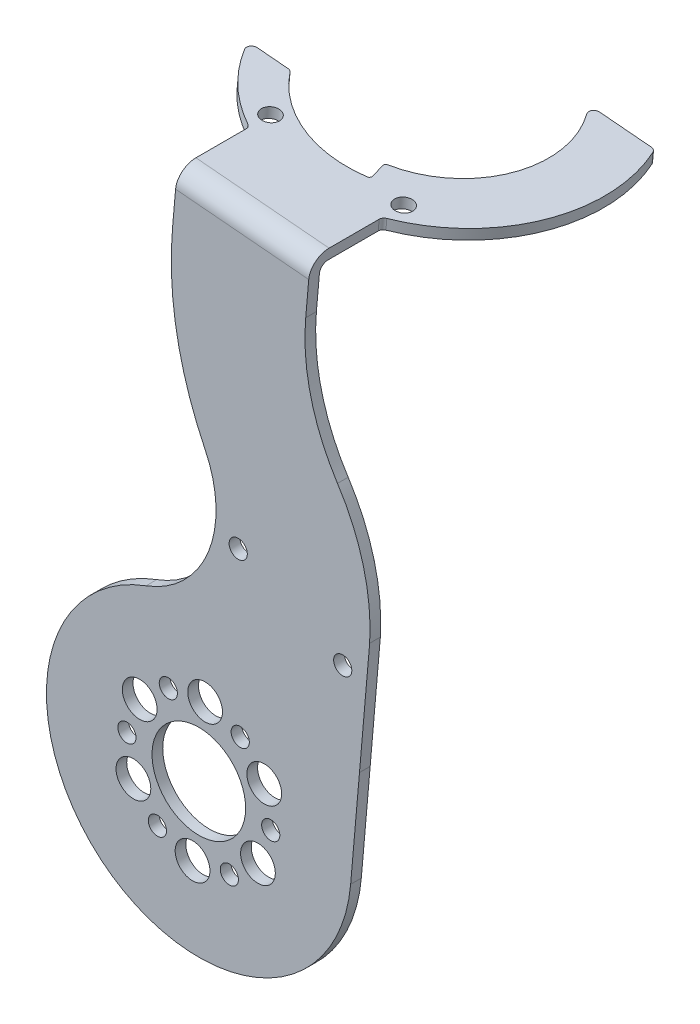
from build123d import *

# Parameters (mm, degrees)
EXTRUDE_1_DEPTH               = 2
EXTRUDE_2_DEPTH               = 2
HOLE_WIZARD_6_5_6_5_1_D       = 6.5
HOLE_WIZARD_6_5_6_5_1_DEPTH   = 51.1
HOLE_WIZARD_3_4_3_4_1_D       = 3.4
HOLE_WIZARD_3_4_3_4_1_DEPTH   = 51.1
HOLE_WIZARD_17_5_17_5_1_D     = 17.5
HOLE_WIZARD_17_5_17_5_1_DEPTH = 51.1
HOLE_WIZARD_3_4_3_4_2_D       = 3.4
HOLE_WIZARD_3_4_3_4_2_DEPTH   = 6.616402139
FILLET_1_R                    = 0.5
FILLET_2_R                    = 1
FILLET_3_R                    = 1.5
FILLET_4_R                    = 3.5


with BuildPart() as part:
    # 草图1 → 凸台-拉伸1 (new body)
    with BuildSketch(Plane.XY.offset(2)):
        with BuildLine():
            Line((19.991405474, 85.081394601), (20.688651416, 93.050952185))
            Line((20.688651416, 93.050952185), (-4.216216036, 95.229845754))
            Line((-4.216216036, 95.229845754), (-4.913461978, 87.260288169))
            ThreePointArc((-4.913461978, 87.260288169), (-4.101645556, 70.349808931), (1.198916656, 54.271021844))
            ThreePointArc((1.198916656, 54.271021844), (1.780962088, 38.051078797), (-9.859178165, 26.740355381))
            ThreePointArc((-9.859178165, 26.740355381), (-17.30251519, -22.646698835), (28.391548896, -2.483938668))
            Line((28.391548896, -2.483938668), (30.047508008, 16.443760595))
            Line((30.047508008, 16.443760595), (31.950173771, 38.33545379))
            ThreePointArc((31.950173771, 38.33545379), (30.780358309, 50.262124766), (25.93459204, 61.222621928))
            ThreePointArc((25.93459204, 61.222621928), (20.968028554, 72.655064005), (19.991405474, 85.081394601))
        make_face()
    extrude(amount=-EXTRUDE_1_DEPTH)

    # 草图2 → 凸台-拉伸2 (add)
    with BuildSketch(Plane(origin=(8.23621769, 94.14039897, 0), x_dir=(-0.9961946980917458, 0.08715574274765517, 0), z_dir=(0.08715574274765517, 0.9961946980917458, 0))):
        with BuildLine():
            Line((-15.491933385, -49.1), (-25.850531909, -49.1))
            ThreePointArc((-25.850531909, -49.1), (-26.858253967, -27.566679809), (-12.5, -11.48750305))
            Line((-12.5, -11.48750305), (-12.5, 2))
            Line((-12.5, 2), (12.5, 2))
            Line((12.5, 2), (12.5, -11.48750305))
            ThreePointArc((12.5, -11.48750305), (19.329574132, -16.156801489), (24.530313512, -22.590909091))
            ThreePointArc((24.530313512, -22.590909091), (24.538246516, -23.595433694), (23.669600757, -24.1))
            Line((23.669600757, -24.1), (17.437387992, -24.1))
            ThreePointArc((17.437387992, -24.1), (7.133948284, -16.553241572), (-5.629314231, -16.091113278))
            Line((-5.629314231, -16.091113278), (-4.658742812, -19.713335127))
            ThreePointArc((-4.658742812, -19.713335127), (-16.934605215, -30.999250357), (-14.67656847, -47.521052632))
            ThreePointArc((-14.67656847, -47.521052632), (-14.603410068, -48.558831468), (-15.491933385, -49.1))
        make_face()
    extrude(amount=EXTRUDE_2_DEPTH)

    # Ø6.5 (6.5) 直径孔1
    with Locations(Plane.XY.offset(2)):
        with Locations((11.058552598, -7.743281891), (1.176602527, 13.448628424), (-12.235155125, -5.705346533), (-11.058552598, 7.743281891), (12.235155125, 5.705346533), (-1.176602527, -13.448628424)):
            Hole(HOLE_WIZARD_6_5_6_5_1_D / 2, depth=HOLE_WIZARD_6_5_6_5_1_DEPTH)

    # Ø3.4 (3.4) 直径孔1
    with Locations(Plane.XY.offset(2)):
        with Locations((13.448628424, -1.176602527), (-5.705346533, 12.235155125), (-7.743281891, -11.058552598), (-13.448628424, 1.176602527), (7.743281891, 11.058552598), (5.705346534, -12.235155125), (26.9127025, 32.244479282), (7.366918218, 41.348863539)):
            Hole(HOLE_WIZARD_3_4_3_4_1_D / 2, depth=HOLE_WIZARD_3_4_3_4_1_DEPTH)

    # Ø17.5 (17.5) 直径孔1
    with Locations(Plane.XY.offset(2)):
        with Locations((0, 0)):
            Hole(HOLE_WIZARD_17_5_17_5_1_D / 2, depth=HOLE_WIZARD_17_5_17_5_1_DEPTH)

    # Ø3.4 (3.4) 直径孔2
    with Locations(Plane(origin=(8.23621769, 94.14039897, 0), x_dir=(0.9961946980917458, -0.08715574274765517, 0), z_dir=(-0.08715574274765517, -0.9961946980917458, 0))):
        with Locations((-25, 37.1), (-12.5, -15.449364905), (12.5, -15.449364905)):
            Hole(HOLE_WIZARD_3_4_3_4_2_D / 2, depth=HOLE_WIZARD_3_4_3_4_2_DEPTH)

    # 圆角1
    fillet_1_edges = [part.edges().sort_by_distance(p)[0] for p in [
        (12.964388321, 94.730557478, -19.713335127),
        (13.931266423, 94.645966605, -16.091113278),
    ]]
    fillet(fillet_1_edges, radius=FILLET_1_R)

    # 圆角2
    fillet_2_edges = [part.edges().sort_by_distance(p)[0] for p in [
        (-9.047660034, 96.65636217, -24.1),
        (-4.129060294, 96.226040452, -11.48750305),
        (20.775807159, 94.047146883, -11.48750305),
        (34.075536263, 92.883571359, -49.1),
    ]]
    fillet(fillet_2_edges, radius=FILLET_2_R)

    # 圆角3
    fillet_3_edges = [part.edges().sort_by_distance(p)[0] for p in [
        (8.23621769, 94.14039897, 0),
    ]]
    fillet(fillet_3_edges, radius=FILLET_3_R)

    # 圆角4
    fillet_4_edges = [part.edges().sort_by_distance(p)[0] for p in [
        (8.410529175, 96.132788366, 2),
    ]]
    fillet(fillet_4_edges, radius=FILLET_4_R)


solid = part.part
